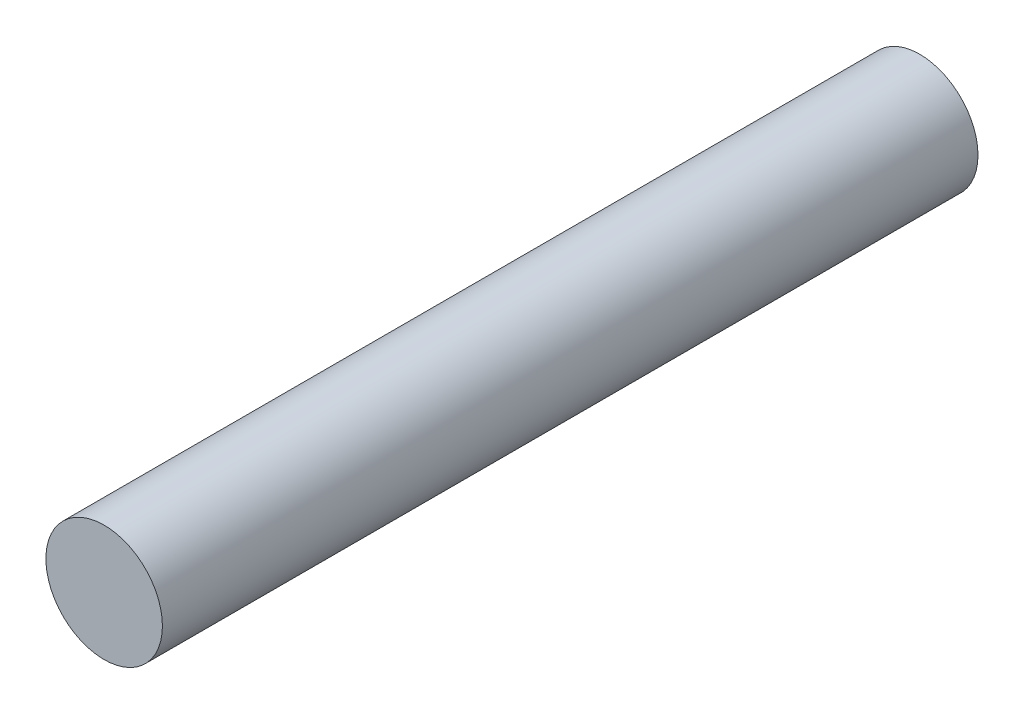
from build123d import *

# Parameters (mm, degrees)
SKETCH1_R           = 1
BOSS_EXTRUDE1_DEPTH = 7


with BuildPart() as part:
    # Sketch1 → Boss-Extrude1 (new, symmetric)
    with BuildSketch(Plane.XY):
        Circle(SKETCH1_R)
    extrude(amount=BOSS_EXTRUDE1_DEPTH, both=True)


solid = part.part
